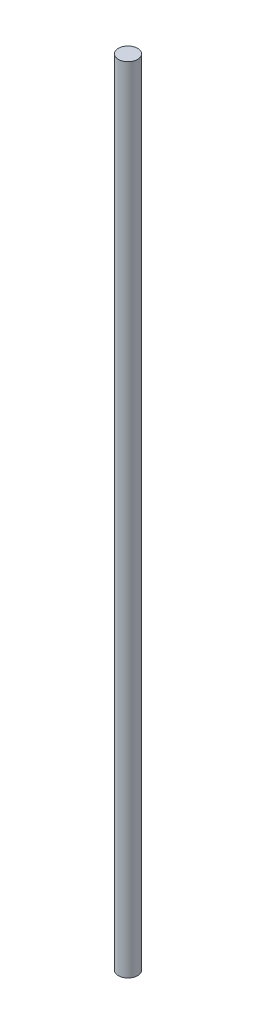
from build123d import *

# Parameters (mm, degrees)
SKETCH1_R           = 4
BOSS_EXTRUDE1_DEPTH = 165


with BuildPart() as part:
    # Sketch1 → Boss-Extrude1 (new, symmetric)
    with BuildSketch(Plane(origin=(0, 0, 0), x_dir=(1, 0, 0), z_dir=(0, 1, 0))):
        with Locations(Location((0, 0, 0), (0, 0, 270))):
            Circle(SKETCH1_R)
    extrude(amount=BOSS_EXTRUDE1_DEPTH, both=True)


solid = part.part
